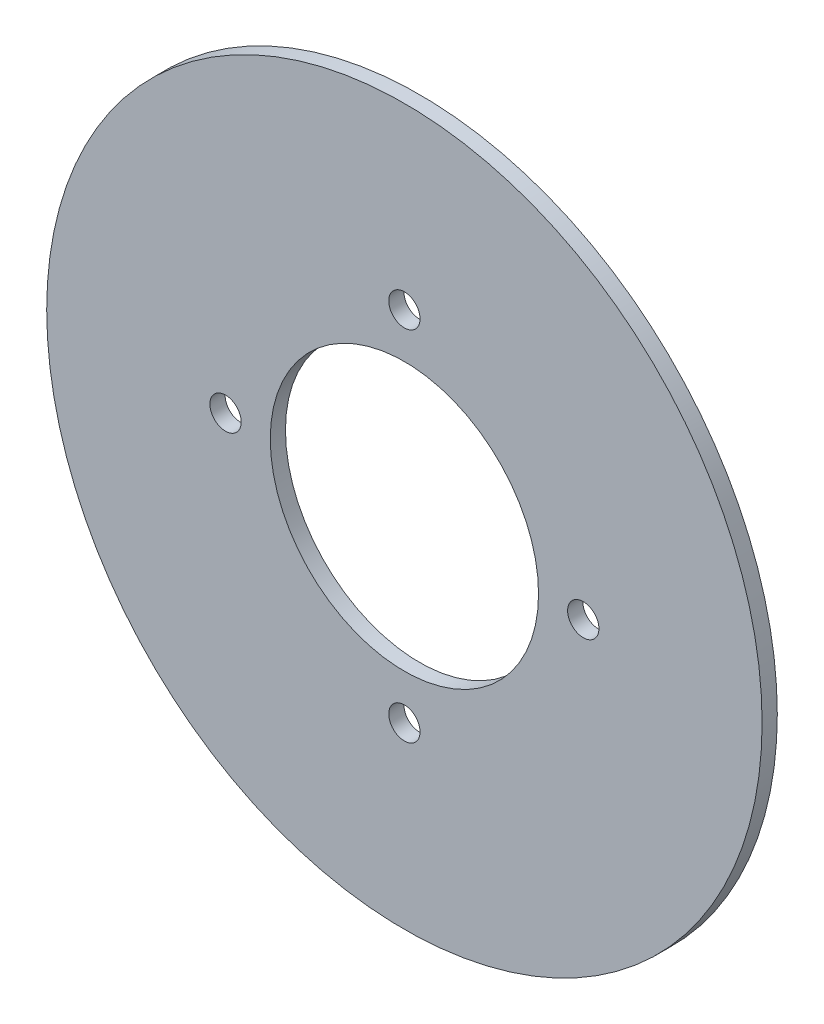
from build123d import *

# Parameters (mm, degrees)
SKETCH1_R           = 40
SKETCH1_R_2         = 15
SKETCH1_R_3         = 1.75
BOSS_EXTRUDE1_DEPTH = 1.7


with BuildPart() as part:
    # Sketch1 → Boss-Extrude1 (new body)
    with BuildSketch(Plane.XY):
        Circle(SKETCH1_R)
        Circle(SKETCH1_R_2, mode=Mode.SUBTRACT)
        with Locations((0, 20)):
            Circle(SKETCH1_R_3, mode=Mode.SUBTRACT)
        with Locations((20, 0)):
            Circle(SKETCH1_R_3, mode=Mode.SUBTRACT)
        with Locations((0, -20)):
            Circle(SKETCH1_R_3, mode=Mode.SUBTRACT)
        with Locations((-20, 0)):
            Circle(SKETCH1_R_3, mode=Mode.SUBTRACT)
    extrude(amount=BOSS_EXTRUDE1_DEPTH)


solid = part.part
